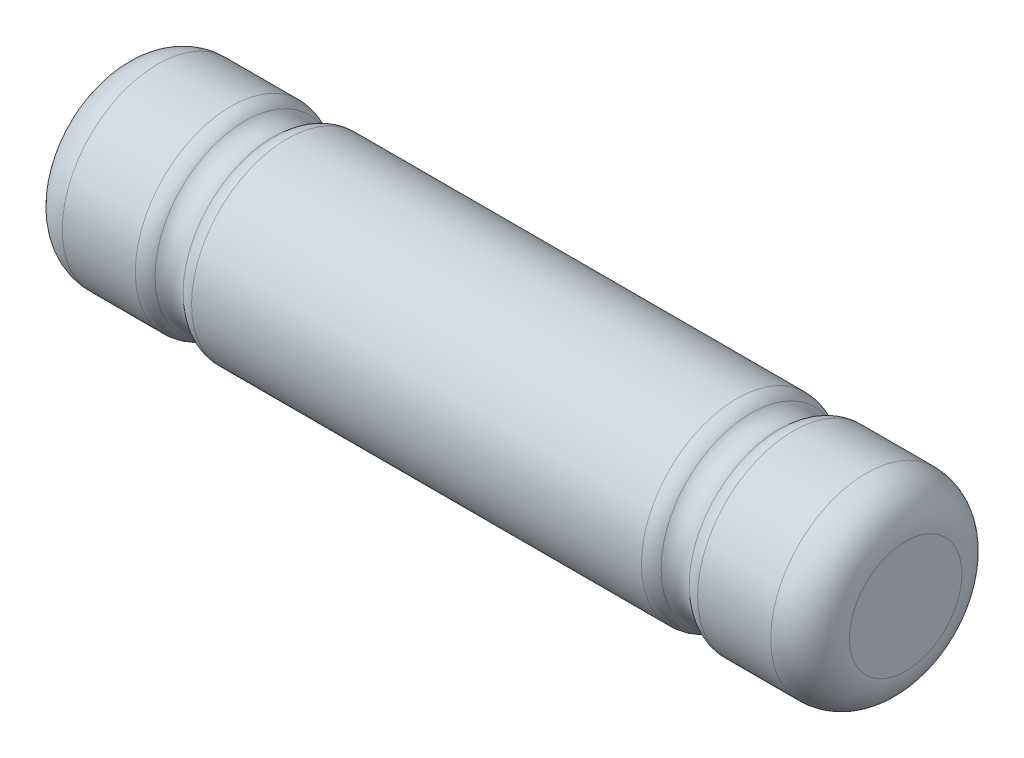
from build123d import *


with BuildPart() as part:
    # Sketch2 → Revolve1 (revolve)
    with BuildSketch(Plane.XY, mode=Mode.PRIVATE) as revolve1_sk:
        with BuildLine():
            Line((-6.3, 1.7), (-5, 1.7))
            ThreePointArc((-5, 1.7), (-4.86537088, 1.6740728), (-4.75, 1.6))
            ThreePointArc((-4.75, 1.6), (-4.5, 1.5), (-4.25, 1.6))
            ThreePointArc((-4.25, 1.6), (-4.13462912, 1.6740728), (-4, 1.7))
            Line((-4, 1.7), (4, 1.7))
            ThreePointArc((4, 1.7), (4.13462912, 1.6740728), (4.25, 1.6))
            ThreePointArc((4.25, 1.6), (4.5, 1.5), (4.75, 1.6))
            ThreePointArc((4.75, 1.6), (4.86537088, 1.6740728), (5, 1.7))
            Line((5, 1.7), (6.3, 1.7))
            ThreePointArc((6.3, 1.7), (6.794974747, 1.494974747), (7, 1))
            Line((7, 1), (7, 0))
            Line((7, 0), (-7, 0))
            Line((-7, 0), (-7, 1))
            ThreePointArc((-7, 1), (-6.794974747, 1.494974747), (-6.3, 1.7))
        make_face()
    revolve(revolve1_sk.sketch.rotate(Axis((-7, 0, 0), (1, 0, 0)), 90), axis=Axis((-7, 0, 0), (1, 0, 0)))


solid = part.part
